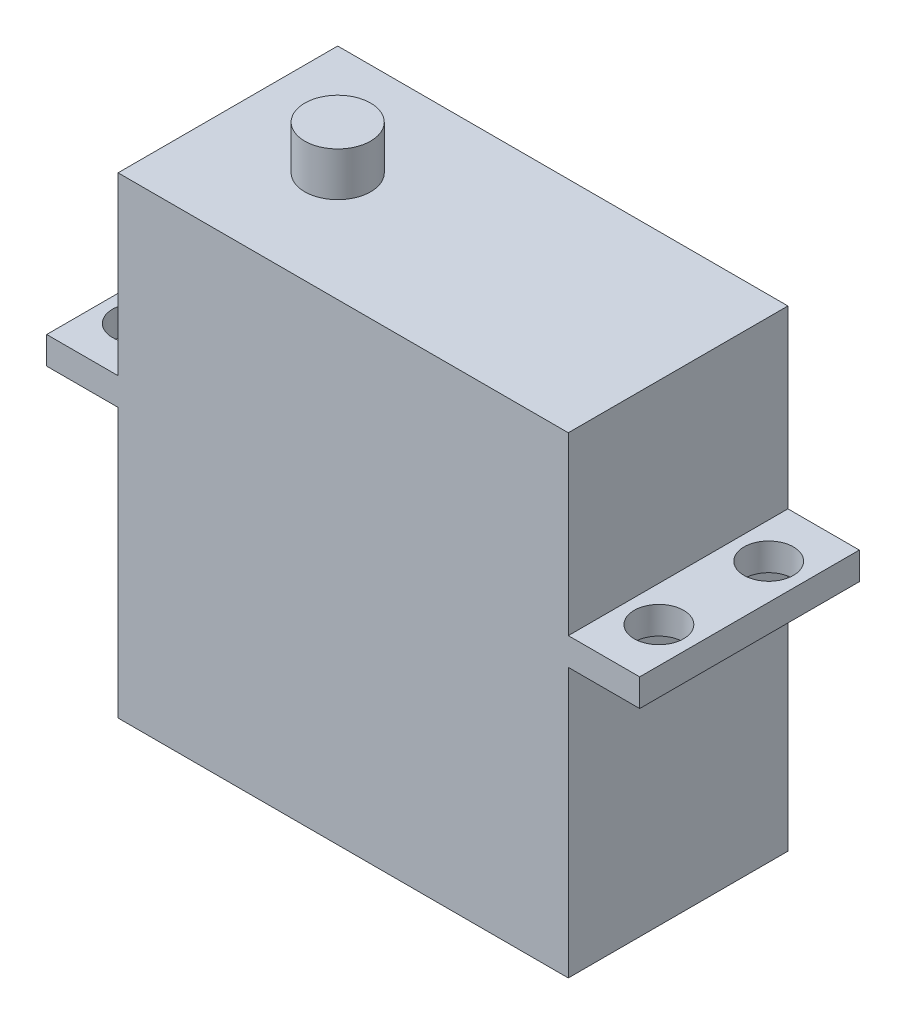
from build123d import *

# Parameters (mm, degrees)
SCHIZZO1_W                        = 41
SCHIZZO1_H                        = 20
ESTRUSIONE_ESTRUSIONE1_DEPTH      = 43
SCHIZZO2_R                        = 3
ESTRUSIONE_ESTRUSIONE4_DEPTH      = 4
ESTRUSIONE_ESTRUSIONE5_DEPTH      = 10
ESTRUSIONE_ESTRUSIONE5_DEPTH_BACK = 10
SCHIZZO4_W                        = 54
SCHIZZO4_H                        = 2.5
FORO_PER_VITE_M1_6_1_D            = 4.5


with BuildPart() as part:
    # Schizzo1 → Estrusione-Estrusione1 (new body)
    with BuildSketch(Plane(origin=(0, 0, 0), x_dir=(1, 0, 0), z_dir=(0, 1, 0))):
        with Locations((10.5, 0)):
            Rectangle(SCHIZZO1_W, SCHIZZO1_H)
    extrude(amount=ESTRUSIONE_ESTRUSIONE1_DEPTH)

    # Schizzo2 → Estrusione-Estrusione4 (add)
    with BuildSketch(Plane(origin=(0, 43, 0), x_dir=(1, 0, 0), z_dir=(0, 1, 0))):
        Circle(SCHIZZO2_R)
    extrude(amount=ESTRUSIONE_ESTRUSIONE4_DEPTH)

    # Schizzo4 → Estrusione-Estrusione5 (add, two sides: drawn at the far end of the back side and taken through both)
    with BuildSketch(Plane.XY.offset(-ESTRUSIONE_ESTRUSIONE5_DEPTH_BACK)):
        with Locations((10.5, 25.75)):
            Rectangle(SCHIZZO4_W, SCHIZZO4_H)
    extrude(amount=ESTRUSIONE_ESTRUSIONE5_DEPTH + ESTRUSIONE_ESTRUSIONE5_DEPTH_BACK)

    # Foro per Vite M1.6-1 (through all)
    with Locations(Plane(origin=(0, 27, 0), x_dir=(1, 0, 0), z_dir=(0, 1, 0))):
        with Locations((-13.250292536, 5), (-13.250292536, -5), (34.250292536, 5), (34.250292536, -5)):
            Hole(FORO_PER_VITE_M1_6_1_D / 2)


solid = part.part
